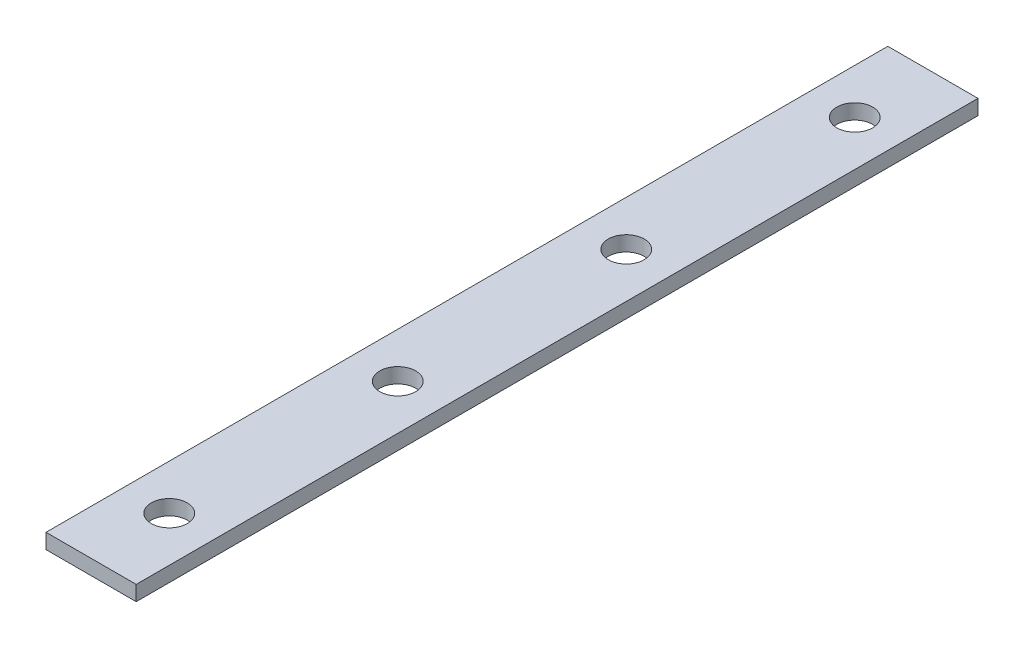
from build123d import *

# Parameters (mm, degrees)
SKETCH1_W           = 9.525
SKETCH1_H           = 88.9
SKETCH1_R           = 1.89865
BOSS_EXTRUDE1_DEPTH = 1.5875


with BuildPart() as part:
    # Sketch1 → Boss-Extrude1 (new body)
    with BuildSketch(Plane(origin=(0, 0, 0), x_dir=(1, 0, 0), z_dir=(0, 1, 0))):
        with Locations((4.7625, 44.45)):
            Rectangle(SKETCH1_W, SKETCH1_H)
        with Locations(Location((4.7625, 8.255, 0), (0, 0, 270))):
            Circle(SKETCH1_R, mode=Mode.SUBTRACT)
        with Locations(Location((4.7625, 32.385, 0), (0, 0, 270))):
            Circle(SKETCH1_R, mode=Mode.SUBTRACT)
        with Locations(Location((4.7625, 56.515, 0), (0, 0, 270))):
            Circle(SKETCH1_R, mode=Mode.SUBTRACT)
        with Locations(Location((4.7625, 80.645, 0), (0, 0, 270))):
            Circle(SKETCH1_R, mode=Mode.SUBTRACT)
    extrude(amount=BOSS_EXTRUDE1_DEPTH)


solid = part.part
